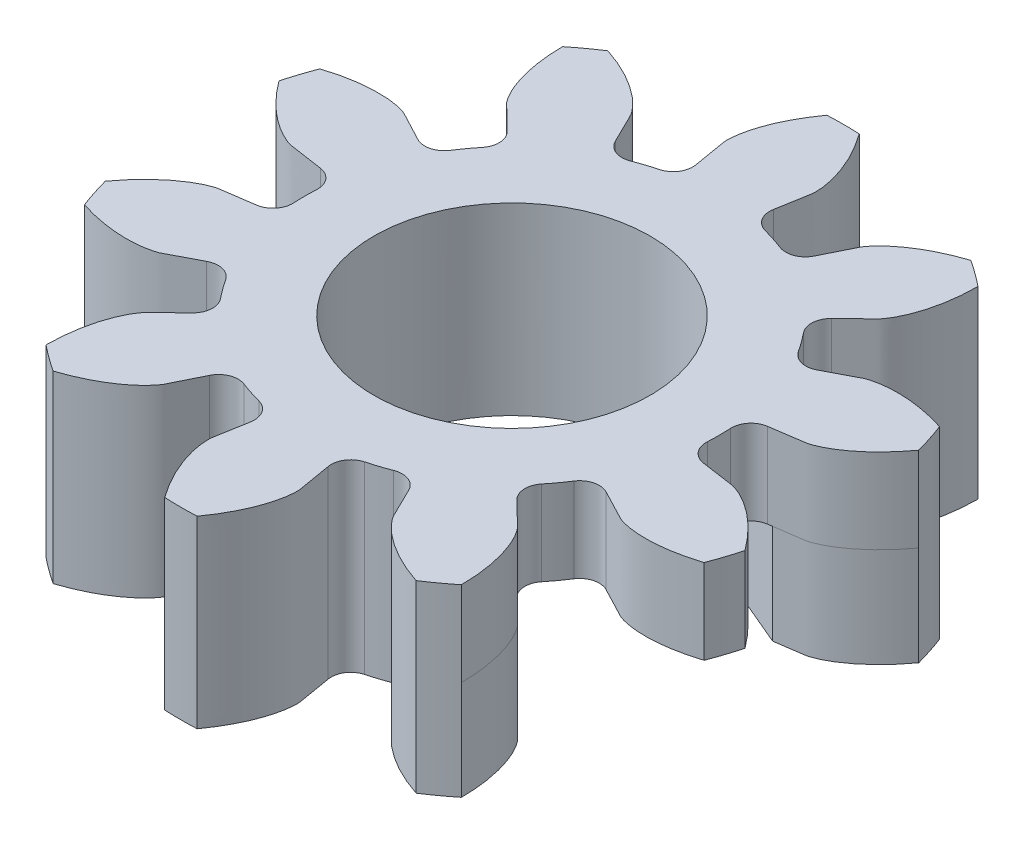
from build123d import *

# Parameters (mm, degrees)
EXTRUDE_1_DEPTH     = 2.7
EXTRUDE_2_DEPTH     = 2.3
CUT_EXTRUDE_1_DEPTH = 14.674794501
CUT_EXTRUDE_2_DEPTH = 14.674794501
CUT_EXTRUDE_3_DEPTH = 14.674794501
CUT_EXTRUDE_4_DEPTH = 14.674794501
CUT_EXTRUDE_5_DEPTH = 14.469744447
CUT_EXTRUDE_6_DEPTH = 14.469744447
CUT_EXTRUDE_7_DEPTH = 14.469744447
CUT_EXTRUDE_8_DEPTH = 14.469744447
SKETCH_11_W         = 3.75
SKETCH_11_H         = 5
FILLET_1_R          = 0.531362809


with BuildPart() as part:
    # 草图1 → 凸台-拉伸1 (new body)
    with BuildSketch(Plane.XZ.offset(5)):
        with BuildLine():
            Line((6.190883636, -0.884711696), (3.011829736, -2.234140023))
            ThreePointArc((3.011829736, -2.234140023), (3.566461936, 1.158813729), (1.123426883, 3.577766348))
            Line((1.123426883, 3.577766348), (4.488509578, 4.354656903))
            add(Edge.make_bspline(
                [(4.488509578, 4.354656903), (4.78110653, 4.637623797), (5.06085177, 4.90921784), (5.078983921, 4.932774398), (5.110608828, 4.971272741), (5.14526524, 5.01982107), (5.188877023, 5.086826564), (5.237338648, 5.170541019), (5.289804674, 5.272444723), (5.344329333, 5.392838958), (5.399246097, 5.532224298), (5.452755098, 5.690876283), (5.503064294, 5.868964912), (5.548331937, 6.066533631), (5.586802445, 6.283436298), (5.616350555, 6.519621592), (5.635507361, 6.763708563), (5.638595868, 6.932847011), (5.639812037, 7.013737963)],
                knots=[0.057559053, 0.057559053, 0.057559053, 0.057559053, 0.176646148, 0.200646968, 0.231631854, 0.268293654, 0.309864221, 0.35582221, 0.405783808, 0.459451173, 0.516584444, 0.576985068, 0.640485148, 0.706940282, 0.776224548, 0.848226869, 0.922848307, 0.990951142, 0.990951142, 0.990951142, 0.990951142], degree=3))
            ThreePointArc((5.639812037, 7.013737963), (-8.559508646, -2.781152954), (8.685275523, -2.359234857))
            add(Edge.make_bspline(
                [(6.190883636, -0.884711696), (6.59392331, -0.941652549), (6.979880936, -0.996946619), (7.008396352, -1.005346465), (7.056610198, -1.017903624), (7.113183816, -1.036809519), (7.187851331, -1.06538374), (7.276263731, -1.104625128), (7.378607132, -1.1562282), (7.493484464, -1.221580392), (7.619841706, -1.302066236), (7.756384695, -1.398966587), (7.901763558, -1.513472311), (8.054513831, -1.646701109), (8.213129314, -1.799566656), (8.37586047, -1.973276628), (8.534829374, -2.159487048), (8.636745113, -2.294507549), (8.685275523, -2.359234857)],
                knots=[0.057559053, 0.057559053, 0.057559053, 0.057559053, 0.176646148, 0.200646968, 0.231631854, 0.268293654, 0.309864221, 0.35582221, 0.405783808, 0.459451173, 0.516584444, 0.576985068, 0.640485148, 0.706940282, 0.776224548, 0.848226869, 0.922848307, 0.990951142, 0.990951142, 0.990951142, 0.990951142], degree=3))
        make_face()
    extrude(amount=-EXTRUDE_1_DEPTH)

    # 草图2 → 凸台-拉伸2 (add)
    with BuildSketch(Plane(origin=(0, -2.3, 0), x_dir=(-1, 0, 0), z_dir=(0, 1, 0))):
        with BuildLine():
            ThreePointArc((-5.639812042, 7.013737957), (8.559508647, -2.781152949), (-8.685275522, -2.359234857))
            add(Edge.make_bspline(
                [(-5.568244384, -0.797044213), (-6.224748743, -0.889336794), (-6.970452005, -0.994169119), (-7.008396351, -1.005346464), (-7.056610197, -1.017903623), (-7.113183815, -1.036809519), (-7.18785133, -1.065383739), (-7.27626373, -1.104625127), (-7.378607131, -1.1562282), (-7.493484463, -1.221580391), (-7.619841705, -1.302066236), (-7.756384694, -1.398966587), (-7.901763557, -1.51347231), (-8.05451383, -1.646701109), (-8.213129313, -1.799566655), (-8.375860469, -1.973276628), (-8.534829373, -2.159487048), (-8.636745112, -2.294507548), (-8.685275522, -2.359234857)],
                knots=[0, 0, 0, 0, 0.176646148, 0.200646968, 0.231631854, 0.268293654, 0.309864221, 0.35582221, 0.405783808, 0.459451173, 0.516584444, 0.576985068, 0.640485148, 0.706940282, 0.776224548, 0.848226869, 0.922848307, 0.990951142, 0.990951142, 0.990951142, 0.990951142], degree=3))
            ThreePointArc((-5.568244384, -0.797044213), (-5.625, 0), (-5.568244384, 0.797044213))
            add(Edge.make_bspline(
                [(-5.568244384, 0.797044213), (-6.224748743, 0.889336794), (-6.970452005, 0.994169119), (-7.008396351, 1.005346464), (-7.056610197, 1.017903623), (-7.113183815, 1.036809519), (-7.18785133, 1.065383739), (-7.27626373, 1.104625127), (-7.378607131, 1.1562282), (-7.493484463, 1.221580391), (-7.619841705, 1.302066236), (-7.756384694, 1.398966587), (-7.901763557, 1.51347231), (-8.05451383, 1.646701109), (-8.213129313, 1.799566655), (-8.375860469, 1.973276628), (-8.534829373, 2.159487048), (-8.636745112, 2.294507548), (-8.685275522, 2.359234857)],
                knots=[0, 0, 0, 0, 0.176646148, 0.200646968, 0.231631854, 0.268293654, 0.309864221, 0.35582221, 0.405783808, 0.459451173, 0.516584444, 0.576985068, 0.640485148, 0.706940282, 0.776224548, 0.848226869, 0.922848307, 0.990951142, 0.990951142, 0.990951142, 0.990951142], degree=3))
            ThreePointArc((-8.685275522, 2.359234857), (-8.559508647, 2.781152949), (-8.413258954, 3.196415771))
            add(Edge.make_bspline(
                [(-4.973295169, 2.628109617), (-5.558666571, 2.939326931), (-6.223572077, 3.292829178), (-6.260839577, 3.306089643), (-6.30722631, 3.324270075), (-6.364107935, 3.342228023), (-6.441310729, 3.362999457), (-6.535903372, 3.383220012), (-6.649032448, 3.401628191), (-6.780383216, 3.416280359), (-6.929916765, 3.425436866), (-7.09733896, 3.427300791), (-7.282257707, 3.420115267), (-7.484145196, 3.402115262), (-7.702319932, 3.371676278), (-7.936076362, 3.326792932), (-8.174136646, 3.269585115), (-8.33595127, 3.220255804), (-8.413258954, 3.196415771)],
                knots=[0, 0, 0, 0, 0.176646148, 0.200646968, 0.231631854, 0.268293654, 0.309864221, 0.35582221, 0.405783808, 0.459451173, 0.516584444, 0.576985068, 0.640485148, 0.706940282, 0.776224548, 0.848226869, 0.922848307, 0.990951142, 0.990951142, 0.990951142, 0.990951142], degree=3))
            ThreePointArc((-4.973295169, 2.628109617), (-4.550720593, 3.306292044), (-4.036313502, 3.917754244))
            add(Edge.make_bspline(
                [(-4.036313502, 3.917754244), (-4.513188467, 4.37830409), (-5.054856184, 4.901428603), (-5.078983926, 4.932774392), (-5.110608834, 4.971272735), (-5.145265246, 5.019821064), (-5.188877029, 5.086826558), (-5.237338654, 5.170541013), (-5.28980468, 5.272444717), (-5.344329339, 5.392838952), (-5.399246103, 5.532224292), (-5.452755104, 5.690876277), (-5.5030643, 5.868964906), (-5.548331943, 6.066533625), (-5.58680245, 6.283436292), (-5.616350561, 6.519621586), (-5.635507367, 6.763708557), (-5.638595873, 6.932847005), (-5.639812042, 7.013737957)],
                knots=[0, 0, 0, 0, 0.176646148, 0.200646968, 0.231631854, 0.268293654, 0.309864221, 0.35582221, 0.405783808, 0.459451173, 0.516584444, 0.576985068, 0.640485148, 0.706940282, 0.776224548, 0.848226869, 0.922848307, 0.990951142, 0.990951142, 0.990951142, 0.990951142], degree=3))
        make_face()
    extrude(amount=EXTRUDE_2_DEPTH)

    # 草图3 → 切除-拉伸1 (cut, through all)
    with BuildSketch(Plane(origin=(0, 0, 0), x_dir=(-1, 0, 0), z_dir=(0, 1, 0))):
        with BuildLine():
            ThreePointArc((-2.478716236, 5.049414899), (-1.738220593, 5.349692904), (-0.962648051, 5.542015313))
            add(Edge.make_bspline(
                [(-0.962648051, 5.542015313), (-1.077743594, 6.194908038), (-1.208477109, 6.936508954), (-1.20957227, 6.976050161), (-1.2125286, 7.025784629), (-1.212030234, 7.08543158), (-1.207928066, 7.165274527), (-1.197928223, 7.261485971), (-1.180476635, 7.374766557), (-1.153822055, 7.504216329), (-1.116322003, 7.649260702), (-1.066358397, 7.809064656), (-1.002381522, 7.982712386), (-0.922875835, 8.16915649), (-0.82650694, 8.367246831), (-0.711585632, 8.575692691), (-0.583613091, 8.784423287), (-0.48669466, 8.923074545), (-0.440132053, 8.989231545)],
                knots=[0, 0, 0, 0, 0.176646148, 0.200646968, 0.231631854, 0.268293654, 0.309864221, 0.35582221, 0.405783808, 0.459451173, 0.516584444, 0.576985068, 0.640485148, 0.706940282, 0.776224548, 0.848226869, 0.922848307, 0.990951142, 0.990951142, 0.990951142, 0.990951142], degree=3))
            ThreePointArc((-0.440132053, 8.989231545), (-2.781152949, 8.559508647), (-4.927663421, 7.531144216))
            add(Edge.make_bspline(
                [(-2.478716236, 5.049414899), (-2.7693627, 5.645267672), (-3.099499147, 6.322078648), (-3.121854882, 6.354711876), (-3.148696348, 6.396685593), (-3.184159132, 6.444648058), (-3.234408362, 6.506831165), (-3.299050073, 6.578790098), (-3.379753362, 6.66017823), (-3.477406038, 6.749238127), (-3.59299916, 6.844539512), (-3.727350974, 6.944455756), (-3.881176928, 7.047335057), (-4.055087475, 7.151439236), (-4.249486129, 7.255053473), (-4.464980823, 7.356140666), (-4.691201549, 7.449786893), (-4.851107371, 7.504990892), (-4.927663421, 7.531144216)],
                knots=[0, 0, 0, 0, 0.176646148, 0.200646968, 0.231631854, 0.268293654, 0.309864221, 0.35582221, 0.405783808, 0.459451173, 0.516584444, 0.576985068, 0.640485148, 0.706940282, 0.776224548, 0.848226869, 0.922848307, 0.990951142, 0.990951142, 0.990951142, 0.990951142], degree=3))
        make_face()
    extrude(amount=-CUT_EXTRUDE_1_DEPTH, mode=Mode.SUBTRACT)

    # 草图4 → 切除-拉伸2 (cut, through all)
    with BuildSketch(Plane(origin=(0, 0, 0), x_dir=(-1, 0, 0), z_dir=(0, 1, 0))):
        with BuildLine():
            ThreePointArc((0.962648051, 5.542015313), (1.738220593, 5.349692904), (2.478716236, 5.049414899))
            add(Edge.make_bspline(
                [(2.478716236, 5.049414899), (2.7693627, 5.645267672), (3.099499147, 6.322078648), (3.121854882, 6.354711876), (3.148696348, 6.396685593), (3.184159132, 6.444648058), (3.234408362, 6.506831165), (3.299050073, 6.578790098), (3.379753362, 6.66017823), (3.477406038, 6.749238127), (3.59299916, 6.844539512), (3.727350974, 6.944455756), (3.881176928, 7.047335057), (4.055087475, 7.151439236), (4.249486129, 7.255053473), (4.464980823, 7.356140666), (4.691201549, 7.449786893), (4.851107371, 7.504990892), (4.927663421, 7.531144216)],
                knots=[0, 0, 0, 0, 0.176646148, 0.200646968, 0.231631854, 0.268293654, 0.309864221, 0.35582221, 0.405783808, 0.459451173, 0.516584444, 0.576985068, 0.640485148, 0.706940282, 0.776224548, 0.848226869, 0.922848307, 0.990951142, 0.990951142, 0.990951142, 0.990951142], degree=3))
            ThreePointArc((4.927663421, 7.531144216), (2.781152949, 8.559508647), (0.440132053, 8.989231545))
            add(Edge.make_bspline(
                [(0.962648051, 5.542015313), (1.077743594, 6.194908038), (1.208477109, 6.936508954), (1.20957227, 6.976050161), (1.2125286, 7.025784629), (1.212030234, 7.08543158), (1.207928066, 7.165274527), (1.197928223, 7.261485971), (1.180476635, 7.374766557), (1.153822055, 7.504216329), (1.116322003, 7.649260702), (1.066358397, 7.809064656), (1.002381522, 7.982712386), (0.922875835, 8.16915649), (0.82650694, 8.367246831), (0.711585632, 8.575692691), (0.583613091, 8.784423287), (0.48669466, 8.923074545), (0.440132053, 8.989231545)],
                knots=[0, 0, 0, 0, 0.176646148, 0.200646968, 0.231631854, 0.268293654, 0.309864221, 0.35582221, 0.405783808, 0.459451173, 0.516584444, 0.576985068, 0.640485148, 0.706940282, 0.776224548, 0.848226869, 0.922848307, 0.990951142, 0.990951142, 0.990951142, 0.990951142], degree=3))
        make_face()
    extrude(amount=-CUT_EXTRUDE_2_DEPTH, mode=Mode.SUBTRACT)

    # 草图5 → 切除-拉伸3 (cut, through all)
    with BuildSketch(Plane(origin=(0, 0, 0), x_dir=(-1, 0, 0), z_dir=(0, 1, 0))):
        with BuildLine():
            ThreePointArc((4.036313502, 3.917754244), (4.550720593, 3.306292044), (4.973295169, 2.628109617))
            add(Edge.make_bspline(
                [(4.973295169, 2.628109617), (5.558666571, 2.939326931), (6.223572077, 3.292829178), (6.260839577, 3.306089643), (6.30722631, 3.324270075), (6.364107935, 3.342228023), (6.441310729, 3.362999457), (6.535903372, 3.383220012), (6.649032448, 3.401628191), (6.780383216, 3.416280359), (6.929916765, 3.425436866), (7.09733896, 3.427300791), (7.282257707, 3.420115267), (7.484145196, 3.402115262), (7.702319932, 3.371676278), (7.936076362, 3.326792932), (8.174136646, 3.269585115), (8.33595127, 3.220255804), (8.413258954, 3.196415771)],
                knots=[0, 0, 0, 0, 0.176646148, 0.200646968, 0.231631854, 0.268293654, 0.309864221, 0.35582221, 0.405783808, 0.459451173, 0.516584444, 0.576985068, 0.640485148, 0.706940282, 0.776224548, 0.848226869, 0.922848307, 0.990951142, 0.990951142, 0.990951142, 0.990951142], degree=3))
            ThreePointArc((8.413258954, 3.196415771), (7.281152949, 5.290067271), (5.639812042, 7.013737957))
            add(Edge.make_bspline(
                [(4.036313502, 3.917754244), (4.513188467, 4.37830409), (5.054856184, 4.901428603), (5.078983926, 4.932774392), (5.110608834, 4.971272735), (5.145265246, 5.019821064), (5.188877029, 5.086826558), (5.237338654, 5.170541013), (5.28980468, 5.272444717), (5.344329339, 5.392838952), (5.399246103, 5.532224292), (5.452755104, 5.690876277), (5.5030643, 5.868964906), (5.548331943, 6.066533625), (5.58680245, 6.283436292), (5.616350561, 6.519621586), (5.635507367, 6.763708557), (5.638595873, 6.932847005), (5.639812042, 7.013737957)],
                knots=[0, 0, 0, 0, 0.176646148, 0.200646968, 0.231631854, 0.268293654, 0.309864221, 0.35582221, 0.405783808, 0.459451173, 0.516584444, 0.576985068, 0.640485148, 0.706940282, 0.776224548, 0.848226869, 0.922848307, 0.990951142, 0.990951142, 0.990951142, 0.990951142], degree=3))
        make_face()
    extrude(amount=-CUT_EXTRUDE_3_DEPTH, mode=Mode.SUBTRACT)

    # 草图6 → 切除-拉伸4 (cut, through all)
    with BuildSketch(Plane(origin=(0, 0, 0), x_dir=(-1, 0, 0), z_dir=(0, 1, 0))):
        with BuildLine():
            ThreePointArc((5.568244384, 0.797044213), (5.625, 0), (5.568244384, -0.797044213))
            add(Edge.make_bspline(
                [(5.568244384, -0.797044213), (6.224748743, -0.889336794), (6.970452005, -0.994169119), (7.008396351, -1.005346464), (7.056610197, -1.017903623), (7.113183815, -1.036809519), (7.18785133, -1.065383739), (7.27626373, -1.104625127), (7.378607131, -1.1562282), (7.493484463, -1.221580391), (7.619841705, -1.302066236), (7.756384694, -1.398966587), (7.901763557, -1.51347231), (8.05451383, -1.646701109), (8.213129313, -1.799566655), (8.375860469, -1.973276628), (8.534829373, -2.159487048), (8.636745112, -2.294507548), (8.685275522, -2.359234857)],
                knots=[0, 0, 0, 0, 0.176646148, 0.200646968, 0.231631854, 0.268293654, 0.309864221, 0.35582221, 0.405783808, 0.459451173, 0.516584444, 0.576985068, 0.640485148, 0.706940282, 0.776224548, 0.848226869, 0.922848307, 0.990951142, 0.990951142, 0.990951142, 0.990951142], degree=3))
            ThreePointArc((8.685275522, -2.359234857), (9, 0), (8.685275522, 2.359234857))
            add(Edge.make_bspline(
                [(5.568244384, 0.797044213), (6.224748743, 0.889336794), (6.970452005, 0.994169119), (7.008396351, 1.005346464), (7.056610197, 1.017903623), (7.113183815, 1.036809519), (7.18785133, 1.065383739), (7.27626373, 1.104625127), (7.378607131, 1.1562282), (7.493484463, 1.221580391), (7.619841705, 1.302066236), (7.756384694, 1.398966587), (7.901763557, 1.51347231), (8.05451383, 1.646701109), (8.213129313, 1.799566655), (8.375860469, 1.973276628), (8.534829373, 2.159487048), (8.636745112, 2.294507548), (8.685275522, 2.359234857)],
                knots=[0, 0, 0, 0, 0.176646148, 0.200646968, 0.231631854, 0.268293654, 0.309864221, 0.35582221, 0.405783808, 0.459451173, 0.516584444, 0.576985068, 0.640485148, 0.706940282, 0.776224548, 0.848226869, 0.922848307, 0.990951142, 0.990951142, 0.990951142, 0.990951142], degree=3))
        make_face()
    extrude(amount=-CUT_EXTRUDE_4_DEPTH, mode=Mode.SUBTRACT)

    # 草图7 → 切除-拉伸5 (cut, through all)
    with BuildSketch(Plane(origin=(0, 0, 0), x_dir=(-1, 0, 0), z_dir=(0, 1, 0))):
        with BuildLine():
            ThreePointArc((4.973295169, -2.628109617), (4.550720593, -3.306292044), (4.036313502, -3.917754244))
            add(Edge.make_bspline(
                [(4.036313502, -3.917754244), (4.513188467, -4.37830409), (5.054856184, -4.901428603), (5.078983926, -4.932774392), (5.110608834, -4.971272735), (5.145265246, -5.019821064), (5.188877029, -5.086826558), (5.237338654, -5.170541013), (5.28980468, -5.272444717), (5.344329339, -5.392838952), (5.399246103, -5.532224292), (5.452755104, -5.690876277), (5.5030643, -5.868964906), (5.548331943, -6.066533625), (5.58680245, -6.283436292), (5.616350561, -6.519621586), (5.635507367, -6.763708557), (5.638595873, -6.932847005), (5.639812042, -7.013737957)],
                knots=[0, 0, 0, 0, 0.176646148, 0.200646968, 0.231631854, 0.268293654, 0.309864221, 0.35582221, 0.405783808, 0.459451173, 0.516584444, 0.576985068, 0.640485148, 0.706940282, 0.776224548, 0.848226869, 0.922848307, 0.990951142, 0.990951142, 0.990951142, 0.990951142], degree=3))
            ThreePointArc((5.639812042, -7.013737957), (7.281152949, -5.290067271), (8.413258954, -3.196415771))
            add(Edge.make_bspline(
                [(4.973295169, -2.628109617), (5.558666571, -2.939326931), (6.223572077, -3.292829178), (6.260839577, -3.306089643), (6.30722631, -3.324270075), (6.364107935, -3.342228023), (6.441310729, -3.362999457), (6.535903372, -3.383220012), (6.649032448, -3.401628191), (6.780383216, -3.416280359), (6.929916765, -3.425436866), (7.09733896, -3.427300791), (7.282257707, -3.420115267), (7.484145196, -3.402115262), (7.702319932, -3.371676278), (7.936076362, -3.326792932), (8.174136646, -3.269585115), (8.33595127, -3.220255804), (8.413258954, -3.196415771)],
                knots=[0, 0, 0, 0, 0.176646148, 0.200646968, 0.231631854, 0.268293654, 0.309864221, 0.35582221, 0.405783808, 0.459451173, 0.516584444, 0.576985068, 0.640485148, 0.706940282, 0.776224548, 0.848226869, 0.922848307, 0.990951142, 0.990951142, 0.990951142, 0.990951142], degree=3))
        make_face()
    extrude(amount=-CUT_EXTRUDE_5_DEPTH, mode=Mode.SUBTRACT)

    # 草图8 → 切除-拉伸6 (cut, through all)
    with BuildSketch(Plane(origin=(0, 0, 0), x_dir=(-1, 0, 0), z_dir=(0, 1, 0))):
        with BuildLine():
            ThreePointArc((2.478716236, -5.049414899), (1.738220593, -5.349692904), (0.962648051, -5.542015313))
            add(Edge.make_bspline(
                [(0.962648051, -5.542015313), (1.077743594, -6.194908038), (1.208477109, -6.936508954), (1.20957227, -6.976050161), (1.2125286, -7.025784629), (1.212030234, -7.08543158), (1.207928066, -7.165274527), (1.197928223, -7.261485971), (1.180476635, -7.374766557), (1.153822055, -7.504216329), (1.116322003, -7.649260702), (1.066358397, -7.809064656), (1.002381522, -7.982712386), (0.922875835, -8.16915649), (0.82650694, -8.367246831), (0.711585632, -8.575692691), (0.583613091, -8.784423287), (0.48669466, -8.923074545), (0.440132053, -8.989231545)],
                knots=[0, 0, 0, 0, 0.176646148, 0.200646968, 0.231631854, 0.268293654, 0.309864221, 0.35582221, 0.405783808, 0.459451173, 0.516584444, 0.576985068, 0.640485148, 0.706940282, 0.776224548, 0.848226869, 0.922848307, 0.990951142, 0.990951142, 0.990951142, 0.990951142], degree=3))
            ThreePointArc((0.440132053, -8.989231545), (2.781152949, -8.559508647), (4.927663421, -7.531144216))
            add(Edge.make_bspline(
                [(2.478716236, -5.049414899), (2.7693627, -5.645267672), (3.099499147, -6.322078648), (3.121854882, -6.354711876), (3.148696348, -6.396685593), (3.184159132, -6.444648058), (3.234408362, -6.506831165), (3.299050073, -6.578790098), (3.379753362, -6.66017823), (3.477406038, -6.749238127), (3.59299916, -6.844539512), (3.727350974, -6.944455756), (3.881176928, -7.047335057), (4.055087475, -7.151439236), (4.249486129, -7.255053473), (4.464980823, -7.356140666), (4.691201549, -7.449786893), (4.851107371, -7.504990892), (4.927663421, -7.531144216)],
                knots=[0, 0, 0, 0, 0.176646148, 0.200646968, 0.231631854, 0.268293654, 0.309864221, 0.35582221, 0.405783808, 0.459451173, 0.516584444, 0.576985068, 0.640485148, 0.706940282, 0.776224548, 0.848226869, 0.922848307, 0.990951142, 0.990951142, 0.990951142, 0.990951142], degree=3))
        make_face()
    extrude(amount=-CUT_EXTRUDE_6_DEPTH, mode=Mode.SUBTRACT)

    # 草图9 → 切除-拉伸7 (cut, through all)
    with BuildSketch(Plane(origin=(0, 0, 0), x_dir=(-1, 0, 0), z_dir=(0, 1, 0))):
        with BuildLine():
            ThreePointArc((-0.962648051, -5.542015313), (-1.738220593, -5.349692904), (-2.478716236, -5.049414899))
            add(Edge.make_bspline(
                [(-2.478716236, -5.049414899), (-2.7693627, -5.645267672), (-3.099499147, -6.322078648), (-3.121854882, -6.354711876), (-3.148696348, -6.396685593), (-3.184159132, -6.444648058), (-3.234408362, -6.506831165), (-3.299050073, -6.578790098), (-3.379753362, -6.66017823), (-3.477406038, -6.749238127), (-3.59299916, -6.844539512), (-3.727350974, -6.944455756), (-3.881176928, -7.047335057), (-4.055087475, -7.151439236), (-4.249486129, -7.255053473), (-4.464980823, -7.356140666), (-4.691201549, -7.449786893), (-4.851107371, -7.504990892), (-4.927663421, -7.531144216)],
                knots=[0, 0, 0, 0, 0.176646148, 0.200646968, 0.231631854, 0.268293654, 0.309864221, 0.35582221, 0.405783808, 0.459451173, 0.516584444, 0.576985068, 0.640485148, 0.706940282, 0.776224548, 0.848226869, 0.922848307, 0.990951142, 0.990951142, 0.990951142, 0.990951142], degree=3))
            ThreePointArc((-4.927663421, -7.531144216), (-2.781152949, -8.559508647), (-0.440132053, -8.989231545))
            add(Edge.make_bspline(
                [(-0.962648051, -5.542015313), (-1.077743594, -6.194908038), (-1.208477109, -6.936508954), (-1.20957227, -6.976050161), (-1.2125286, -7.025784629), (-1.212030234, -7.08543158), (-1.207928066, -7.165274527), (-1.197928223, -7.261485971), (-1.180476635, -7.374766557), (-1.153822055, -7.504216329), (-1.116322003, -7.649260702), (-1.066358397, -7.809064656), (-1.002381522, -7.982712386), (-0.922875835, -8.16915649), (-0.82650694, -8.367246831), (-0.711585632, -8.575692691), (-0.583613091, -8.784423287), (-0.48669466, -8.923074545), (-0.440132053, -8.989231545)],
                knots=[0, 0, 0, 0, 0.176646148, 0.200646968, 0.231631854, 0.268293654, 0.309864221, 0.35582221, 0.405783808, 0.459451173, 0.516584444, 0.576985068, 0.640485148, 0.706940282, 0.776224548, 0.848226869, 0.922848307, 0.990951142, 0.990951142, 0.990951142, 0.990951142], degree=3))
        make_face()
    extrude(amount=-CUT_EXTRUDE_7_DEPTH, mode=Mode.SUBTRACT)

    # 草图10 → 切除-拉伸8 (cut, through all)
    with BuildSketch(Plane(origin=(0, 0, 0), x_dir=(-1, 0, 0), z_dir=(0, 1, 0))):
        with BuildLine():
            ThreePointArc((-4.036313502, -3.917754244), (-4.550720593, -3.306292044), (-4.973295169, -2.628109617))
            add(Edge.make_bspline(
                [(-4.973295169, -2.628109617), (-5.558666571, -2.939326931), (-6.223572077, -3.292829178), (-6.260839577, -3.306089643), (-6.30722631, -3.324270075), (-6.364107935, -3.342228023), (-6.441310729, -3.362999457), (-6.535903372, -3.383220012), (-6.649032448, -3.401628191), (-6.780383216, -3.416280359), (-6.929916765, -3.425436866), (-7.09733896, -3.427300791), (-7.282257707, -3.420115267), (-7.484145196, -3.402115262), (-7.702319932, -3.371676278), (-7.936076362, -3.326792932), (-8.174136646, -3.269585115), (-8.33595127, -3.220255804), (-8.413258954, -3.196415771)],
                knots=[0, 0, 0, 0, 0.176646148, 0.200646968, 0.231631854, 0.268293654, 0.309864221, 0.35582221, 0.405783808, 0.459451173, 0.516584444, 0.576985068, 0.640485148, 0.706940282, 0.776224548, 0.848226869, 0.922848307, 0.990951142, 0.990951142, 0.990951142, 0.990951142], degree=3))
            ThreePointArc((-8.413258954, -3.196415771), (-7.281152949, -5.290067271), (-5.639812042, -7.013737957))
            add(Edge.make_bspline(
                [(-4.036313502, -3.917754244), (-4.513188467, -4.37830409), (-5.054856184, -4.901428603), (-5.078983926, -4.932774392), (-5.110608834, -4.971272735), (-5.145265246, -5.019821064), (-5.188877029, -5.086826558), (-5.237338654, -5.170541013), (-5.28980468, -5.272444717), (-5.344329339, -5.392838952), (-5.399246103, -5.532224292), (-5.452755104, -5.690876277), (-5.5030643, -5.868964906), (-5.548331943, -6.066533625), (-5.58680245, -6.283436292), (-5.616350561, -6.519621586), (-5.635507367, -6.763708557), (-5.638595873, -6.932847005), (-5.639812042, -7.013737957)],
                knots=[0, 0, 0, 0, 0.176646148, 0.200646968, 0.231631854, 0.268293654, 0.309864221, 0.35582221, 0.405783808, 0.459451173, 0.516584444, 0.576985068, 0.640485148, 0.706940282, 0.776224548, 0.848226869, 0.922848307, 0.990951142, 0.990951142, 0.990951142, 0.990951142], degree=3))
        make_face()
    extrude(amount=-CUT_EXTRUDE_8_DEPTH, mode=Mode.SUBTRACT)

    # 草图11 → 切除-旋转1 (revolve, cut)
    with BuildSketch(Plane.XY, mode=Mode.PRIVATE) as cut_revolve_1_sk:
        with Locations((1.875, -2.5)):
            Rectangle(SKETCH_11_W, SKETCH_11_H)
    revolve(cut_revolve_1_sk.sketch.rotate(Axis((0, 0, 0), (0, -1, 0)), 270), axis=Axis((0, 0, 0), (0, -1, 0)), mode=Mode.SUBTRACT)

    # 圆角1
    fillet_1_edges = [part.edges().sort_by_distance(p)[0] for p in [
        (-0.962648051, -2.5, -5.542015313),
        (-5.568244384, -2.5, -0.797044213),
        (4.973295169, -2.5, -2.628109617),
        (5.568244384, -1.15, 0.797044213),
        (-4.036313502, -2.5, -3.917754244),
        (4.973295169, -1.15, 2.628109617),
        (2.478716236, -2.5, -5.049414899),
        (4.036313502, -1.15, 3.917754244),
        (-5.568244384, -2.5, 0.797044213),
        (2.478716236, -2.5, 5.049414899),
        (-4.973295169, -2.5, -2.628109617),
        (0.962648051, -2.5, 5.542015313),
        (-2.478716236, -2.5, -5.049414899),
        (-0.962648051, -2.5, 5.542015313),
        (0.962648051, -2.5, -5.542015313),
        (-2.478716236, -2.5, 5.049414899),
        (4.036313502, -2.5, -3.917754244),
        (-4.036313502, -2.5, 3.917754244),
        (5.568244384, -1.15, -0.797044213),
        (-4.973295169, -2.5, 2.628109617),
    ]]
    fillet(fillet_1_edges, radius=FILLET_1_R)


solid = part.part
